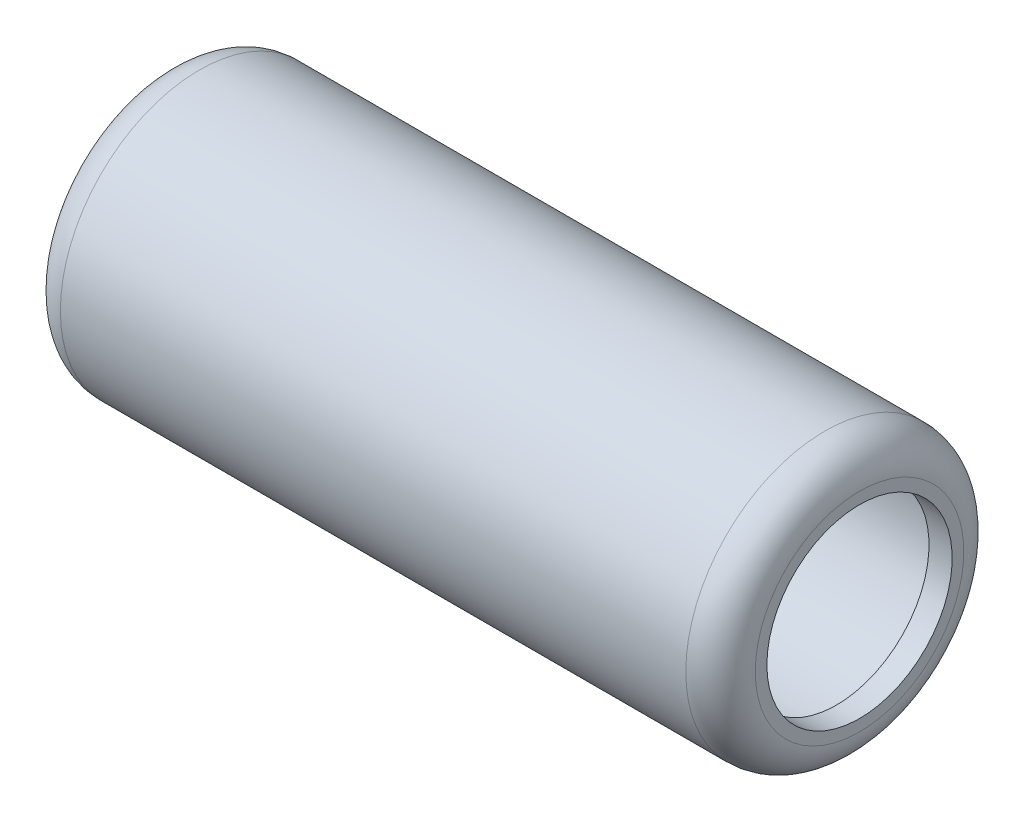
from build123d import *


with BuildPart() as part:
    # Esquisse1 → Base-Révolution (revolve)
    with BuildSketch(Plane.XY, mode=Mode.PRIVATE) as base_r_volution_sk:
        with BuildLine():
            Line((1.5, 6), (28.5, 6))
            ThreePointArc((28.5, 6), (29.560660172, 5.560660172), (30, 4.5))
            Line((30, 4.5), (30, 4))
            Line((30, 4), (29, 4))
            Line((29, 4), (29, 4.5))
            ThreePointArc((29, 4.5), (28.853553391, 4.853553391), (28.5, 5))
            Line((28.5, 5), (1.5, 5))
            ThreePointArc((1.5, 5), (1.146446609, 4.853553391), (1, 4.5))
            Line((1, 4.5), (1, 4))
            Line((1, 4), (0, 4))
            Line((0, 4), (0, 4.5))
            ThreePointArc((0, 4.5), (0.439339828, 5.560660172), (1.5, 6))
        make_face()
    revolve(base_r_volution_sk.sketch.rotate(Axis((0, 0, 0), (1, 0, 0)), 90), axis=Axis((0, 0, 0), (1, 0, 0)))


solid = part.part
